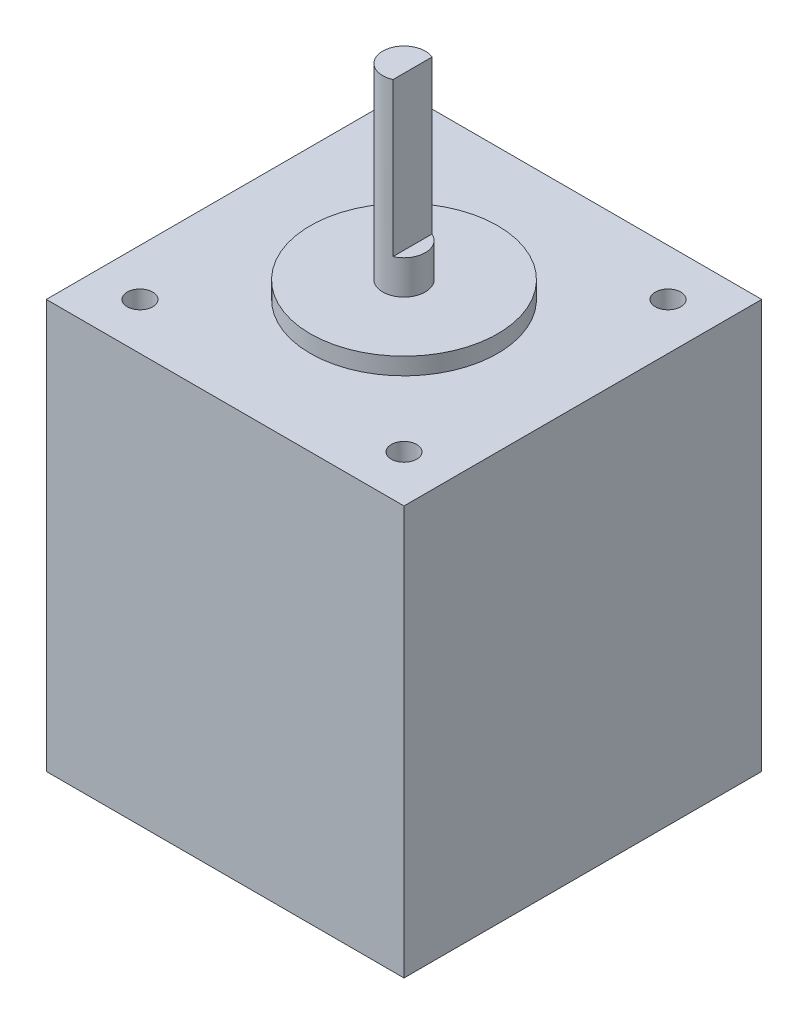
from build123d import *

# Parameters (mm, degrees)
SKETCH_1_W          = 42
SKETCH_1_H          = 42
EXTRUDE_1_DEPTH     = 48
SKETCH_2_R          = 11
EXTRUDE_2_DEPTH     = 2
SKETCH_3_R          = 1.5
CUT_EXTRUDE_1_DEPTH = 78.640195775
SKETCH_4_R          = 2.5
EXTRUDE_3_DEPTH     = 22
CUT_EXTRUDE_START   = -18
CUT_EXTRUDE_2_DEPTH = 18


with BuildPart() as part:
    # 草图1 → 凸台-拉伸1 (new body)
    with BuildSketch(Plane(origin=(0, 0, 0), x_dir=(1, 0, 0), z_dir=(0, 1, 0))):
        with Locations((21, 21)):
            Rectangle(SKETCH_1_W, SKETCH_1_H)
    extrude(amount=EXTRUDE_1_DEPTH)

    # 草图2 → 凸台-拉伸2 (add)
    with BuildSketch(Plane(origin=(0, 48, 0), x_dir=(1, 0, 0), z_dir=(0, 1, 0))):
        with Locations(Location((21, 21, 0), (0, 0, 270))):
            Circle(SKETCH_2_R)
    extrude(amount=EXTRUDE_2_DEPTH)

    # 草图3 → 切除-拉伸1 (cut, through all)
    with BuildSketch(Plane.XZ):
        with Locations(Location((36.5, -5.5, 0), (0, 0, 270))):
            Circle(SKETCH_3_R)
        with Locations(Location((5.5, -5.5, 0), (0, 0, 270))):
            Circle(SKETCH_3_R)
        with Locations(Location((5.5, -36.5, 0), (0, 0, 270))):
            Circle(SKETCH_3_R)
        with Locations(Location((36.5, -36.5, 0), (0, 0, 270))):
            Circle(SKETCH_3_R)
    extrude(amount=-CUT_EXTRUDE_1_DEPTH, mode=Mode.SUBTRACT)

    # 草图4 → 凸台-拉伸3 (add)
    with BuildSketch(Plane(origin=(0, 50, 0), x_dir=(1, 0, 0), z_dir=(0, 1, 0))):
        with Locations(Location((21, 21, 0), (0, 0, 270))):
            Circle(SKETCH_4_R)
    extrude(amount=EXTRUDE_3_DEPTH)

    # 草图5 → 切除-拉伸2 (cut)
    with BuildSketch(Plane(origin=(0, 72, 0), x_dir=(1, 0, 0), z_dir=(0, 1, 0)).offset(CUT_EXTRUDE_START)):
        with BuildLine():
            Line((22, 23.291287847), (22, 21))
            Line((22, 21), (22, 18.708712153))
            ThreePointArc((22, 18.708712153), (23.091650066, 19.630693606), (23.5, 21))
            ThreePointArc((23.5, 21), (23.091650066, 22.369306394), (22, 23.291287847))
        make_face()
    extrude(amount=CUT_EXTRUDE_2_DEPTH, mode=Mode.SUBTRACT)


solid = part.part
